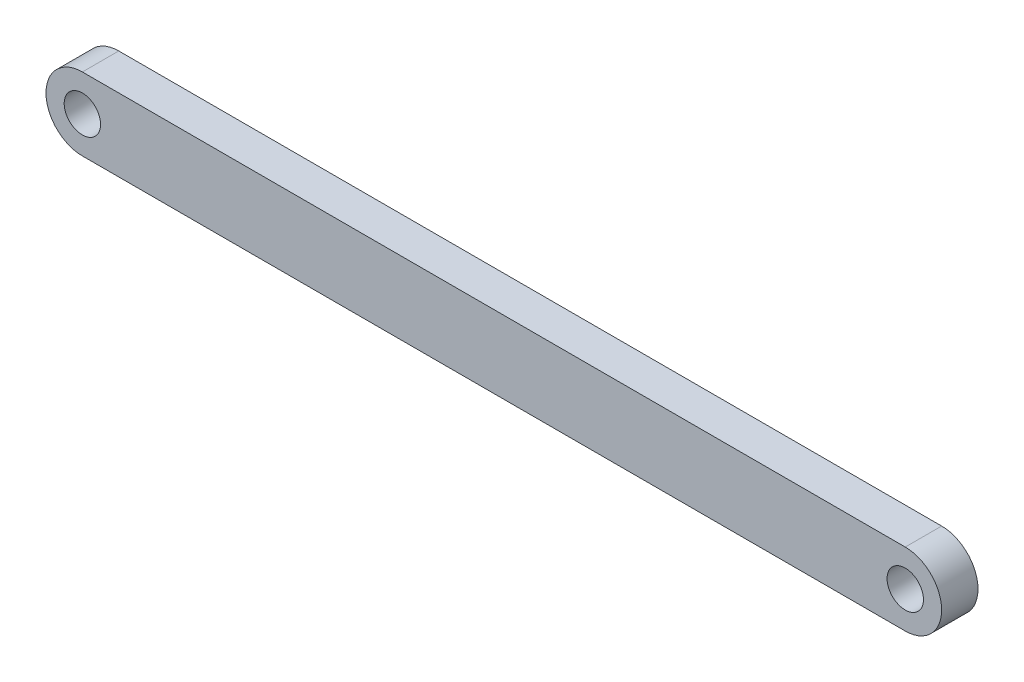
from build123d import *

# Parameters (mm, degrees)
ESBO_O1_R                = 2.5
RESSALTO_EXTRUS_O1_DEPTH = 5


with BuildPart() as part:
    # Esboço1 → Ressalto-extrusão1 (new body)
    with BuildSketch(Plane.XY):
        with BuildLine():
            Line((-56.55, 5), (56.55, 5))
            ThreePointArc((56.55, 5), (61.55, 0), (56.55, -5))
            Line((56.55, -5), (-56.55, -5))
            ThreePointArc((-56.55, -5), (-61.55, 0), (-56.55, 5))
        make_face()
        with Locations((-56.55, 0)):
            Circle(ESBO_O1_R, mode=Mode.SUBTRACT)
        with Locations((56.55, 0)):
            Circle(ESBO_O1_R, mode=Mode.SUBTRACT)
    extrude(amount=RESSALTO_EXTRUS_O1_DEPTH)


solid = part.part
